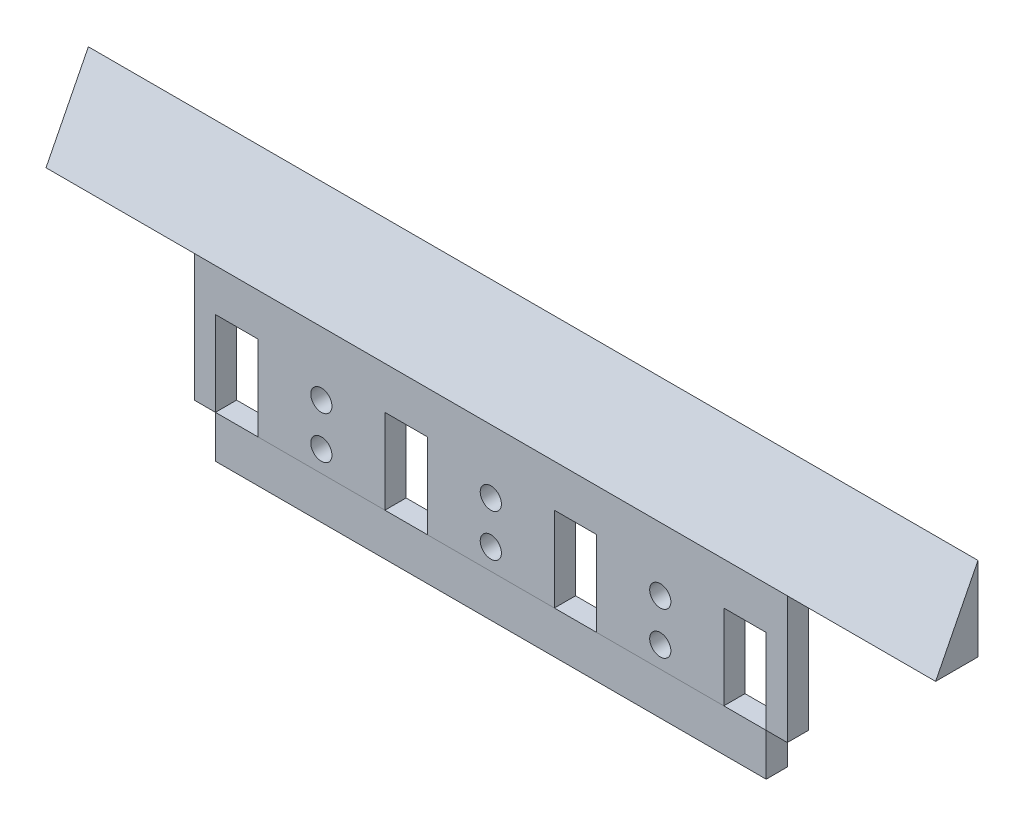
from build123d import *

# Parameters (mm, degrees)
SKETCH_1_W          = 140
SKETCH_1_H          = 30
EXTRUDE_1_DEPTH     = 5
SKETCH_2_W          = 10
SKETCH_2_H          = 20
CUT_EXTRUDE_1_DEPTH = 50
EXTRUDE_2_DEPTH     = 140
EXTRUDE_3_DEPTH     = 35
EXTRUDE_4_DEPTH     = 35
SKETCH_6_W          = 130
SKETCH_6_H          = 5
EXTRUDE_7_DEPTH     = 10
SKETCH_8_R          = 2.5
CUT_EXTRUDE_2_DEPTH = 10


with BuildPart() as part:
    # 스케치1 → 보스-돌출1 (new body)
    with BuildSketch(Plane.XY):
        with Locations((7933.764003989, 2320.877862595)):
            Rectangle(SKETCH_1_W, SKETCH_1_H)
    extrude(amount=EXTRUDE_1_DEPTH)

    # 스케치2 → 컷-돌출1 (cut)
    with BuildSketch(Plane(origin=(0, 0, 0), x_dir=(-1, 0, 0), z_dir=(0, 0, -1))):
        with Locations((-7993.764003989, 2315.877862595)):
            Rectangle(SKETCH_2_W, SKETCH_2_H)
        with Locations((-7953.764003989, 2315.877862595)):
            Rectangle(SKETCH_2_W, SKETCH_2_H)
        with Locations((-7913.764003989, 2315.877862595)):
            Rectangle(SKETCH_2_W, SKETCH_2_H)
        with Locations((-7873.764003989, 2315.877862595)):
            Rectangle(SKETCH_2_W, SKETCH_2_H)
    extrude(amount=-CUT_EXTRUDE_1_DEPTH, mode=Mode.SUBTRACT)

    # 스케치3 → 보스-돌출2 (add)
    with BuildSketch(Plane.ZY.offset(-7863.764003989)):
        Polygon((-5, 2335.877862595), (0, 2335.877862595), (5, 2335.877862595), (-5, 2355.6147047), align=None)
    extrude(amount=-EXTRUDE_2_DEPTH)

    # 스케치4 → 보스-돌출3 (add)
    with BuildSketch(Plane(origin=(8003.764003989, 0, 0), x_dir=(0, 0, -1), z_dir=(1, 0, 0))):
        Polygon((-5, 2335.877862595), (5, 2335.877862595), (5, 2355.614704701), align=None)
    extrude(amount=EXTRUDE_3_DEPTH)

    # 스케치5 → 보스-돌출4 (add)
    with BuildSketch(Plane.ZY.offset(-7863.764003989)):
        Polygon((5, 2335.877862595), (-5, 2335.877862595), (-5, 2355.6147047), align=None)
    extrude(amount=EXTRUDE_4_DEPTH)

    # 스케치8 → 컷-돌출2 (cut)
    with BuildSketch(Plane.XY.offset(5)):
        with BuildLine():
            ThreePointArc((7896.264003989, 2320.877862595), (7895.531770942, 2322.645629548), (7893.764003989, 2323.377862595))
            Line((7893.764003989, 2323.377862595), (7893.764003989, 2318.377862595))
            ThreePointArc((7893.764003989, 2318.377862595), (7895.531770942, 2319.110095642), (7896.264003989, 2320.877862595))
        make_face()
        with BuildLine():
            Line((7893.764003989, 2318.377862595), (7893.764003989, 2323.377862595))
            ThreePointArc((7893.764003989, 2323.377862595), (7891.264003989, 2320.877862595), (7893.764003989, 2318.377862595))
        make_face()
        with BuildLine():
            ThreePointArc((7896.264003989, 2310.877862595), (7895.531770942, 2312.645629548), (7893.764003989, 2313.377862595))
            Line((7893.764003989, 2313.377862595), (7893.764003989, 2308.377862595))
            ThreePointArc((7893.764003989, 2308.377862595), (7895.531770942, 2309.110095642), (7896.264003989, 2310.877862595))
        make_face()
        with BuildLine():
            Line((7893.764003989, 2308.377862595), (7893.764003989, 2313.377862595))
            ThreePointArc((7893.764003989, 2313.377862595), (7891.264003989, 2310.877862595), (7893.764003989, 2308.377862595))
        make_face()
        with BuildLine():
            ThreePointArc((7936.264003989, 2320.877862595), (7935.531770942, 2322.645629548), (7933.764003989, 2323.377862595))
            Line((7933.764003989, 2323.377862595), (7933.764003989, 2318.377862595))
            ThreePointArc((7933.764003989, 2318.377862595), (7935.531770942, 2319.110095642), (7936.264003989, 2320.877862595))
        make_face()
        with BuildLine():
            Line((7933.764003989, 2318.377862595), (7933.764003989, 2323.377862595))
            ThreePointArc((7933.764003989, 2323.377862595), (7931.264003989, 2320.877862595), (7933.764003989, 2318.377862595))
        make_face()
        with BuildLine():
            ThreePointArc((7933.764003989, 2313.377862595), (7931.264003989, 2310.877862595), (7933.764003989, 2308.377862595))
            Line((7933.764003989, 2308.377862595), (7933.764003989, 2313.377862595))
        make_face()
        with BuildLine():
            Line((7933.764003989, 2313.377862595), (7933.764003989, 2308.377862595))
            ThreePointArc((7933.764003989, 2308.377862595), (7935.531770942, 2309.110095642), (7936.264003989, 2310.877862595))
            ThreePointArc((7936.264003989, 2310.877862595), (7935.531770942, 2312.645629548), (7933.764003989, 2313.377862595))
        make_face()
        with BuildLine():
            ThreePointArc((7976.264003989, 2320.877862595), (7975.531770942, 2322.645629548), (7973.764003989, 2323.377862595))
            Line((7973.764003989, 2323.377862595), (7973.764003989, 2318.377862595))
            ThreePointArc((7973.764003989, 2318.377862595), (7975.531770942, 2319.110095642), (7976.264003989, 2320.877862595))
        make_face()
        with BuildLine():
            Line((7973.764003989, 2318.377862595), (7973.764003989, 2323.377862595))
            ThreePointArc((7973.764003989, 2323.377862595), (7971.264003989, 2320.877862595), (7973.764003989, 2318.377862595))
        make_face()
        with Locations((7973.764003989, 2310.877862595)):
            Circle(SKETCH_8_R)
    extrude(amount=-CUT_EXTRUDE_2_DEPTH, mode=Mode.SUBTRACT)


with BuildPart() as body_2:
    # 스케치6 → 보스-돌출7 (new body)
    with BuildSketch(Plane.XZ.offset(-2305.877862595)):
        with Locations((7933.764003989, 2.5)):
            Rectangle(SKETCH_6_W, SKETCH_6_H)
    extrude(amount=EXTRUDE_7_DEPTH)


solid = Compound([part.part, body_2.part])
